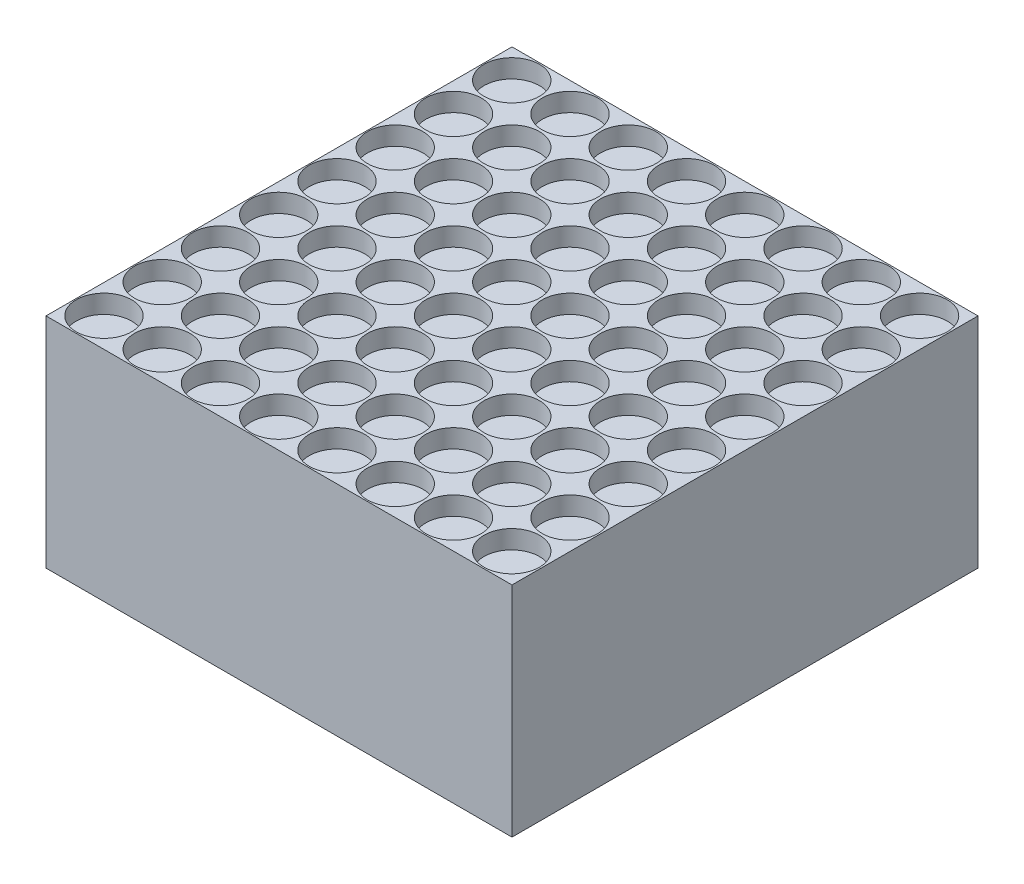
from build123d import *

# Parameters (mm, degrees)
SKETCH1_W           = 32
SKETCH1_H           = 32
BOSS_EXTRUDE1_DEPTH = 15
SKETCH3_R           = 1.905
CUT_EXTRUDE2_DEPTH  = 1.27


with BuildPart() as part:
    # Sketch1 → Boss-Extrude1 (new body)
    with BuildSketch(Plane(origin=(0, 0, 0), x_dir=(1, 0, 0), z_dir=(0, 1, 0))):
        with Locations((3.664804469, -4.290502793)):
            Rectangle(SKETCH1_W, SKETCH1_H)
    extrude(amount=BOSS_EXTRUDE1_DEPTH)

    # Sketch3 → Cut-Extrude2 (cut)
    with BuildSketch(Plane(origin=(0, 15, 0), x_dir=(1, 0, 0), z_dir=(0, 1, 0))):
        with Locations(Location((-10.35324974, -18.293353039, 0), (0, 0, 270))):
            Circle(SKETCH3_R)
        with Locations(Location((-6.35274974, -18.293353039, 0), (0, 0, 270))):
            Circle(SKETCH3_R)
        with Locations(Location((-2.35224974, -18.293353039, 0), (0, 0, 270))):
            Circle(SKETCH3_R)
        with Locations(Location((1.64825026, -18.293353039, 0), (0, 0, 270))):
            Circle(SKETCH3_R)
        with Locations(Location((5.64875026, -18.293353039, 0), (0, 0, 270))):
            Circle(SKETCH3_R)
        with Locations(Location((9.64925026, -18.293353039, 0), (0, 0, 270))):
            Circle(SKETCH3_R)
        with Locations(Location((13.64975026, -18.293353039, 0), (0, 0, 270))):
            Circle(SKETCH3_R)
        with Locations(Location((17.65025026, -18.293353039, 0), (0, 0, 270))):
            Circle(SKETCH3_R)
        with Locations(Location((-6.35274974, -14.292853039, 0), (0, 0, 270))):
            Circle(SKETCH3_R)
        with Locations(Location((-2.35224974, -14.292853039, 0), (0, 0, 270))):
            Circle(SKETCH3_R)
        with Locations(Location((1.64825026, -14.292853039, 0), (0, 0, 270))):
            Circle(SKETCH3_R)
        with Locations(Location((5.64875026, -14.292853039, 0), (0, 0, 270))):
            Circle(SKETCH3_R)
        with Locations(Location((9.64925026, -14.292853039, 0), (0, 0, 270))):
            Circle(SKETCH3_R)
        with Locations(Location((13.64975026, -14.292853039, 0), (0, 0, 270))):
            Circle(SKETCH3_R)
        with Locations(Location((17.65025026, -14.292853039, 0), (0, 0, 270))):
            Circle(SKETCH3_R)
        with Locations(Location((-6.35274974, -10.292353039, 0), (0, 0, 270))):
            Circle(SKETCH3_R)
        with Locations(Location((-2.35224974, -10.292353039, 0), (0, 0, 270))):
            Circle(SKETCH3_R)
        with Locations(Location((1.64825026, -10.292353039, 0), (0, 0, 270))):
            Circle(SKETCH3_R)
        with Locations(Location((5.64875026, -10.292353039, 0), (0, 0, 270))):
            Circle(SKETCH3_R)
        with Locations(Location((9.64925026, -10.292353039, 0), (0, 0, 270))):
            Circle(SKETCH3_R)
        with Locations(Location((13.64975026, -10.292353039, 0), (0, 0, 270))):
            Circle(SKETCH3_R)
        with Locations(Location((17.65025026, -10.292353039, 0), (0, 0, 270))):
            Circle(SKETCH3_R)
        with Locations(Location((-6.35274974, -6.291853039, 0), (0, 0, 270))):
            Circle(SKETCH3_R)
        with Locations(Location((-2.35224974, -6.291853039, 0), (0, 0, 270))):
            Circle(SKETCH3_R)
        with Locations(Location((1.64825026, -6.291853039, 0), (0, 0, 270))):
            Circle(SKETCH3_R)
        with Locations(Location((5.64875026, -6.291853039, 0), (0, 0, 270))):
            Circle(SKETCH3_R)
        with Locations(Location((9.64925026, -6.291853039, 0), (0, 0, 270))):
            Circle(SKETCH3_R)
        with Locations(Location((13.64975026, -6.291853039, 0), (0, 0, 270))):
            Circle(SKETCH3_R)
        with Locations(Location((17.65025026, -6.291853039, 0), (0, 0, 270))):
            Circle(SKETCH3_R)
        with Locations(Location((-6.35274974, -2.291353039, 0), (0, 0, 270))):
            Circle(SKETCH3_R)
        with Locations(Location((-2.35224974, -2.291353039, 0), (0, 0, 270))):
            Circle(SKETCH3_R)
        with Locations(Location((1.64825026, -2.291353039, 0), (0, 0, 270))):
            Circle(SKETCH3_R)
        with Locations(Location((5.64875026, -2.291353039, 0), (0, 0, 270))):
            Circle(SKETCH3_R)
        with Locations(Location((9.64925026, -2.291353039, 0), (0, 0, 270))):
            Circle(SKETCH3_R)
        with Locations(Location((13.64975026, -2.291353039, 0), (0, 0, 270))):
            Circle(SKETCH3_R)
        with Locations(Location((17.65025026, -2.291353039, 0), (0, 0, 270))):
            Circle(SKETCH3_R)
        with Locations(Location((-6.35274974, 1.709146961, 0), (0, 0, 270))):
            Circle(SKETCH3_R)
        with Locations(Location((-2.35224974, 1.709146961, 0), (0, 0, 270))):
            Circle(SKETCH3_R)
        with Locations(Location((1.64825026, 1.709146961, 0), (0, 0, 270))):
            Circle(SKETCH3_R)
        with Locations(Location((5.64875026, 1.709146961, 0), (0, 0, 270))):
            Circle(SKETCH3_R)
        with Locations(Location((9.64925026, 1.709146961, 0), (0, 0, 270))):
            Circle(SKETCH3_R)
        with Locations(Location((13.64975026, 1.709146961, 0), (0, 0, 270))):
            Circle(SKETCH3_R)
        with Locations(Location((17.65025026, 1.709146961, 0), (0, 0, 270))):
            Circle(SKETCH3_R)
        with Locations(Location((-6.35274974, 5.709646961, 0), (0, 0, 270))):
            Circle(SKETCH3_R)
        with Locations(Location((-2.35224974, 5.709646961, 0), (0, 0, 270))):
            Circle(SKETCH3_R)
        with Locations(Location((1.64825026, 5.709646961, 0), (0, 0, 270))):
            Circle(SKETCH3_R)
        with Locations(Location((5.64875026, 5.709646961, 0), (0, 0, 270))):
            Circle(SKETCH3_R)
        with Locations(Location((9.64925026, 5.709646961, 0), (0, 0, 270))):
            Circle(SKETCH3_R)
        with Locations(Location((13.64975026, 5.709646961, 0), (0, 0, 270))):
            Circle(SKETCH3_R)
        with Locations(Location((17.65025026, 5.709646961, 0), (0, 0, 270))):
            Circle(SKETCH3_R)
        with Locations(Location((-6.35274974, 9.710146961, 0), (0, 0, 270))):
            Circle(SKETCH3_R)
        with Locations(Location((-2.35224974, 9.710146961, 0), (0, 0, 270))):
            Circle(SKETCH3_R)
        with Locations(Location((1.64825026, 9.710146961, 0), (0, 0, 270))):
            Circle(SKETCH3_R)
        with Locations(Location((5.64875026, 9.710146961, 0), (0, 0, 270))):
            Circle(SKETCH3_R)
        with Locations(Location((9.64925026, 9.710146961, 0), (0, 0, 270))):
            Circle(SKETCH3_R)
        with Locations(Location((13.64975026, 9.710146961, 0), (0, 0, 270))):
            Circle(SKETCH3_R)
        with Locations(Location((17.65025026, 9.710146961, 0), (0, 0, 270))):
            Circle(SKETCH3_R)
        with Locations(Location((-10.35324974, -14.292853039, 0), (0, 0, 270))):
            Circle(SKETCH3_R)
        with Locations(Location((-10.35324974, -10.292353039, 0), (0, 0, 270))):
            Circle(SKETCH3_R)
        with Locations(Location((-10.35324974, -6.291853039, 0), (0, 0, 270))):
            Circle(SKETCH3_R)
        with Locations(Location((-10.35324974, -2.291353039, 0), (0, 0, 270))):
            Circle(SKETCH3_R)
        with Locations(Location((-10.35324974, 1.709146961, 0), (0, 0, 270))):
            Circle(SKETCH3_R)
        with Locations(Location((-10.35324974, 5.709646961, 0), (0, 0, 270))):
            Circle(SKETCH3_R)
        with Locations(Location((-10.35324974, 9.710146961, 0), (0, 0, 270))):
            Circle(SKETCH3_R)
    extrude(amount=-CUT_EXTRUDE2_DEPTH, mode=Mode.SUBTRACT)


solid = part.part
